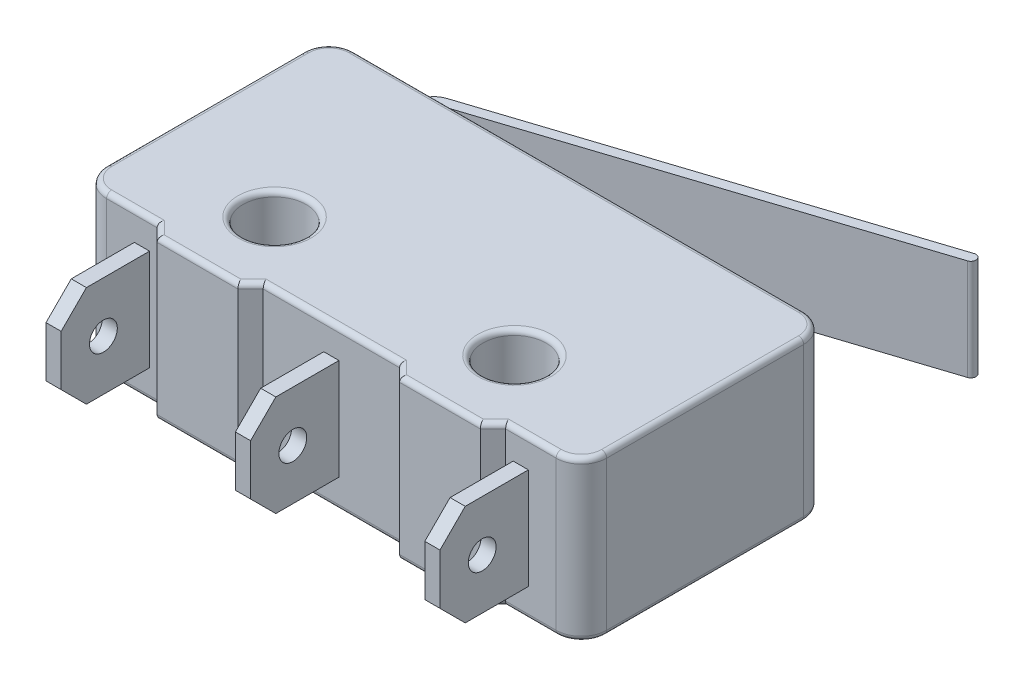
from build123d import *

# Parameters (mm, degrees)
SKETCH_1_R          = 1.25
EXTRUDE_1_DEPTH     = 3.15
SKETCH_1_3_W        = 0.6
SKETCH_1_3_H        = 3.5
EXTRUDE_2_DEPTH     = 2
FILLET_1_R          = 0.2
CHAMFER_1_SIZE      = 1
SKETCH_2_R          = 0.551513833
CUT_EXTRUDE_1_DEPTH = 23.635491064


with BuildPart() as part:
    # 草图1 → 凸台-拉伸1 (new, symmetric)
    with BuildSketch(Plane(origin=(0, 0, 0), x_dir=(1, 0, 0), z_dir=(0, 1, 0))):
        with BuildLine():
            ThreePointArc((-8.9, 7.3), (-9.607106781, 7.007106781), (-9.9, 6.3))
            Line((-9.9, 6.3), (-9.9, -1.5))
            ThreePointArc((-9.9, -1.5), (-9.607106781, -2.207106781), (-8.9, -2.5))
            Line((-8.9, -2.5), (-7.8, -2.5))
            Line((-7.8, -2.5), (-7.2, -2.5))
            Line((-7.2, -2.5), (-6.9, -2.5))
            Line((-6.9, -2.5), (-6.4, -3))
            Line((-6.4, -3), (-3.2, -3))
            Line((-3.2, -3), (-2.7, -2.5))
            Line((-2.7, -2.5), (-0.3, -2.5))
            Line((-0.3, -2.5), (0.3, -2.5))
            Line((0.3, -2.5), (2.7, -2.5))
            Line((2.7, -2.5), (3.2, -3))
            Line((3.2, -3), (6.4, -3))
            Line((6.4, -3), (6.9, -2.5))
            Line((6.9, -2.5), (7.2, -2.5))
            Line((7.2, -2.5), (7.8, -2.5))
            Line((7.8, -2.5), (8.9, -2.5))
            ThreePointArc((8.9, -2.5), (9.607106781, -2.207106781), (9.9, -1.5))
            Line((9.9, -1.5), (9.9, 6.3))
            ThreePointArc((9.9, 6.3), (9.607106781, 7.007106781), (8.9, 7.3))
            Line((8.9, 7.3), (-6.7, 7.3))
            Line((-6.7, 7.3), (-7.1, 7.3))
            Line((-7.1, 7.3), (-8.9, 7.3))
        make_face()
        with Locations((-4.75, 0)):
            Circle(SKETCH_1_R, mode=Mode.SUBTRACT)
        with Locations((4.75, 0)):
            Circle(SKETCH_1_R, mode=Mode.SUBTRACT)
    extrude(amount=EXTRUDE_1_DEPTH, both=True)

    # 草图1<3> → 凸台-拉伸2 (add, symmetric)
    with BuildSketch(Plane(origin=(0, 0, 0), x_dir=(1, 0, 0), z_dir=(0, 1, 0))):
        with BuildLine():
            Line((-7.1, 7.864074483), (-7.1, 7.3))
            Line((-7.1, 7.3), (-6.7, 7.3))
            Line((-6.7, 7.3), (-6.7, 7.864074483))
            ThreePointArc((-6.7, 7.864074483), (-6.623606798, 8.099188584), (-6.423606798, 8.24449709))
            Line((-6.423606798, 8.24449709), (9.329764176, 13.363077601))
            ThreePointArc((9.329764176, 13.363077601), (9.45817208, 13.615092303), (9.206157378, 13.743500208))
            Line((9.206157378, 13.743500208), (-6.547213595, 8.624919696))
            ThreePointArc((-6.547213595, 8.624919696), (-6.947213595, 8.334302685), (-7.1, 7.864074483))
        make_face()
        with Locations((-7.5, -4.25)):
            Rectangle(SKETCH_1_3_W, SKETCH_1_3_H)
        with Locations((7.5, -4.25)):
            Rectangle(SKETCH_1_3_W, SKETCH_1_3_H)
        with Locations((0, -4.25)):
            Rectangle(SKETCH_1_3_W, SKETCH_1_3_H)
    extrude(amount=EXTRUDE_2_DEPTH, both=True)

    # 圆角1
    fillet_1_edges = [part.edges().sort_by_distance(p)[0] for p in [
        (-7.9, -3.15, 2.5),
        (-9.607106781, -3.15, 2.207106781),
        (-9.9, -3.15, -2.4),
        (-9.607106781, -3.15, -7.007106781),
        (0, -3.15, -7.3),
        (9.607106781, -3.15, -7.007106781),
        (7.9, -3.15, 2.5),
        (9.607106781, -3.15, 2.207106781),
        (-7.9, 3.15, 2.5),
        (-9.607106781, 3.15, 2.207106781),
        (-9.9, 3.15, -2.4),
        (-9.607106781, 3.15, -7.007106781),
        (0, 3.15, -7.3),
        (9.607106781, 3.15, -7.007106781),
        (7.9, 3.15, 2.5),
        (9.607106781, 3.15, 2.207106781),
        (3.5, 3.15, 0),
        (-6, 3.15, 0),
        (6.65, 3.15, 2.75),
        (4.8, 3.15, 3),
        (2.95, 3.15, 2.75),
        (0, 3.15, 2.5),
        (-2.95, 3.15, 2.75),
        (-4.8, 3.15, 3),
        (-6.65, 3.15, 2.75),
        (-6.65, -3.15, 2.75),
        (-4.8, -3.15, 3),
        (-2.95, -3.15, 2.75),
        (6.65, -3.15, 2.75),
        (4.8, -3.15, 3),
        (2.95, -3.15, 2.75),
        (0, -3.15, 2.5),
        (-6, -3.15, 0),
        (3.5, -3.15, 0),
        (9.9, -3.15, -2.4),
        (9.9, 3.15, -2.4),
    ]]
    fillet(fillet_1_edges, radius=FILLET_1_R)

    # 倒角1
    chamfer_1_edges = [part.edges().sort_by_distance(p)[0] for p in [
        (-7.5, -2, 6),
        (0, -2, 6),
        (7.5, -2, 6),
        (7.5, 2, 6),
        (0, 2, 6),
        (-7.5, 2, 6),
    ]]
    chamfer(chamfer_1_edges, length=CHAMFER_1_SIZE)

    # 草图2 → 切除-拉伸1 (cut, through all)
    with BuildSketch(Plane(origin=(7.8, 0, 0), x_dir=(0, 0, -1), z_dir=(1, 0, 0))):
        with Locations((-4.328174901, 0)):
            Circle(SKETCH_2_R)
    extrude(amount=-CUT_EXTRUDE_1_DEPTH, mode=Mode.SUBTRACT)


solid = part.part
